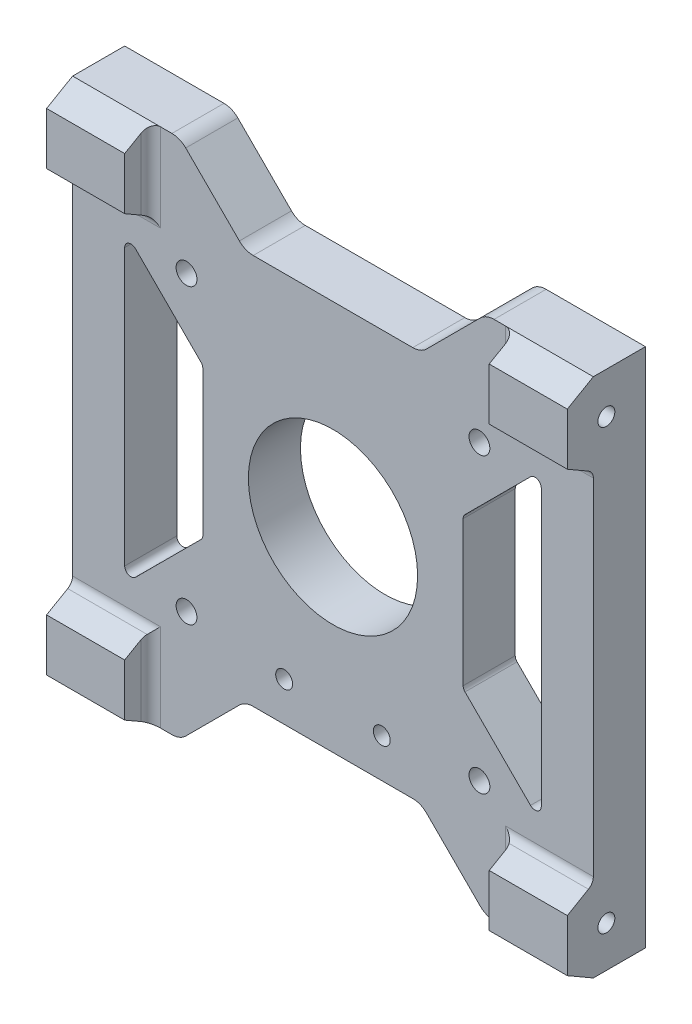
from build123d import *

# Parameters (mm, degrees)
SKETCH_1_W             = 80
SKETCH_1_H             = 80
EXTRUDE_1_DEPTH        = 8
SKETCH_6_R             = 13
CUT_EXTRUDE_3_DEPTH    = 50
EXTRUDE_2_DEPTH        = 12
FILLET_1_R             = 1.5
FILLET_1_OF_MIRROR_1_R = 1.5
SKETCH_8_R             = 1.3
CUT_EXTRUDE_4_DEPTH    = 10
SKETCH_9_R             = 1.3
CUT_EXTRUDE_5_DEPTH    = 10
SKETCH_10_R            = 1.6
CUT_EXTRUDE_6_DEPTH    = 10
CUT_EXTRUDE_7_DEPTH    = 10
FILLET_2_R             = 3


with BuildPart() as part:
    # 草图1 → 凸台-拉伸1 (new body)
    with BuildSketch(Plane.XY):
        Rectangle(SKETCH_1_W, SKETCH_1_H)
    extrude(amount=EXTRUDE_1_DEPTH)

    # 草图6 → 切除-拉伸3 (cut)
    with BuildSketch(Plane.XY.offset(8)):
        Circle(SKETCH_6_R)
    extrude(amount=-CUT_EXTRUDE_3_DEPTH, mode=Mode.SUBTRACT)

    # 草图7 → 凸台-拉伸2 (add)
    with BuildSketch(Plane.ZY.offset(40)):
        Polygon((8, 40), (8, 27.381197846), (12, 29.690598923), (12, 37.690598923), align=None)
        Polygon((12, -37.690598923), (8, -40), (8, -27.381197846), (12, -29.690598923), align=None)
    extrude_2 = extrude(amount=-EXTRUDE_2_DEPTH)

    # 圆角1
    fillet_1_edges = [part.edges().sort_by_distance(p)[0] for p in [
        (-28, 33.690598923, 8),
        (-34, 27.381197846, 8),
        (-28, -33.690598923, 8),
        (-34, -27.381197846, 8),
    ]]
    fillet(fillet_1_edges, radius=FILLET_1_R)

    # 镜向1: 凸台-拉伸2 across plane
    add(extrude_2.mirror(Plane(origin=(0, 0, 0), x_dir=(0, 0, 1), z_dir=(1, 0, 0))))

    # 圆角1 of 镜向1
    fillet_1_of_mirror_1_edges = [part.edges().sort_by_distance(p)[0] for p in [
        (28, 33.690598923, 8),
        (34, 27.381197846, 8),
        (28, -33.690598923, 8),
        (34, -27.381197846, 8),
    ]]
    fillet(fillet_1_of_mirror_1_edges, radius=FILLET_1_OF_MIRROR_1_R)

    # 草图8 → 切除-拉伸4 (cut)
    with BuildSketch(Plane.ZY.offset(40)):
        with Locations(Location((6, 33.690598923, 0), (0, 0, 270))):
            Circle(SKETCH_8_R)
        with Locations(Location((6, -33.690598923, 0), (0, 0, 270))):
            Circle(SKETCH_8_R)
    cut_extrude_4 = extrude(amount=-CUT_EXTRUDE_4_DEPTH, mode=Mode.SUBTRACT)

    # 镜向2: 切除-拉伸4 across plane
    add(cut_extrude_4.mirror(Plane(origin=(0, 0, 0), x_dir=(0, 0, 1), z_dir=(1, 0, 0))), mode=Mode.SUBTRACT)

    # 草图9 → 切除-拉伸5 (cut)
    with BuildSketch(Plane.XY.offset(8)):
        with Locations((7.5, -24)):
            Circle(SKETCH_9_R)
        with Locations((-7.5, -24)):
            Circle(SKETCH_9_R)
    extrude(amount=-CUT_EXTRUDE_5_DEPTH, mode=Mode.SUBTRACT)

    # 草图10 → 切除-拉伸6 (cut)
    with BuildSketch(Plane.XY.offset(8)):
        with Locations((22.5, -22.5)):
            Circle(SKETCH_10_R)
        with Locations((-22.5, -22.5)):
            Circle(SKETCH_10_R)
        with Locations((22.5, 22.5)):
            Circle(SKETCH_10_R)
        with Locations((-22.5, 22.5)):
            Circle(SKETCH_10_R)
    extrude(amount=-CUT_EXTRUDE_6_DEPTH, mode=Mode.SUBTRACT)

    # 草图11 → 切除-拉伸7 (cut)
    with BuildSketch(Plane.XY.offset(8)):
        with BuildLine():
            Line((-23.5, 40), (-14.378679656, 30.878679656))
            ThreePointArc((-14.378679656, 30.878679656), (-13.40540961, 30.228361402), (-12.257359313, 30))
            Line((-12.257359313, 30), (12.257359313, 30))
            ThreePointArc((12.257359313, 30), (13.40540961, 30.228361402), (14.378679656, 30.878679656))
            Line((14.378679656, 30.878679656), (23.5, 40))
            Line((23.5, 40), (-23.5, 40))
        make_face()
        with BuildLine():
            Line((-32, 21.178048171), (-32, -21.178048171))
            ThreePointArc((-32, -21.178048171), (-31.402395233, -22.072426909), (-30.347403579, -21.862576022))
            Line((-30.347403579, -21.862576022), (-20.28354072, -11.798713162))
            ThreePointArc((-20.28354072, -11.798713162), (-20.073689832, -11.484649115), (-20, -11.114185312))
            Line((-20, -11.114185312), (-20, 11.114185312))
            ThreePointArc((-20, 11.114185312), (-20.073689832, 11.484649115), (-20.28354072, 11.798713162))
            Line((-20.28354072, 11.798713162), (-30.347403579, 21.862576022))
            ThreePointArc((-30.347403579, 21.862576022), (-31.402395233, 22.072426909), (-32, 21.178048171))
        make_face()
        with BuildLine():
            Line((-23.5, -40), (23.5, -40))
            Line((23.5, -40), (14.378679656, -30.878679656))
            ThreePointArc((14.378679656, -30.878679656), (13.40540961, -30.228361402), (12.257359313, -30))
            Line((12.257359313, -30), (-12.257359313, -30))
            ThreePointArc((-12.257359313, -30), (-13.40540961, -30.228361402), (-14.378679656, -30.878679656))
            Line((-14.378679656, -30.878679656), (-23.5, -40))
        make_face()
        with BuildLine():
            Line((20.28354072, 11.798713162), (30.347403579, 21.862576022))
            ThreePointArc((30.347403579, 21.862576022), (31.402395233, 22.072426909), (32, 21.178048171))
            Line((32, 21.178048171), (32, -21.178048171))
            ThreePointArc((32, -21.178048171), (31.402395233, -22.072426909), (30.347403579, -21.862576022))
            Line((30.347403579, -21.862576022), (20.28354072, -11.798713162))
            ThreePointArc((20.28354072, -11.798713162), (20.073689832, -11.484649115), (20, -11.114185312))
            Line((20, -11.114185312), (20, 11.114185312))
            ThreePointArc((20, 11.114185312), (20.073689832, 11.484649115), (20.28354072, 11.798713162))
        make_face()
    extrude(amount=-CUT_EXTRUDE_7_DEPTH, mode=Mode.SUBTRACT)

    # 圆角2
    fillet_2_edges = [part.edges().sort_by_distance(p)[0] for p in [
        (-23.5, 40, 4),
        (23.5, 40, 4),
        (-23.5, -40, 4),
        (23.5, -40, 4),
    ]]
    fillet(fillet_2_edges, radius=FILLET_2_R)


solid = part.part
